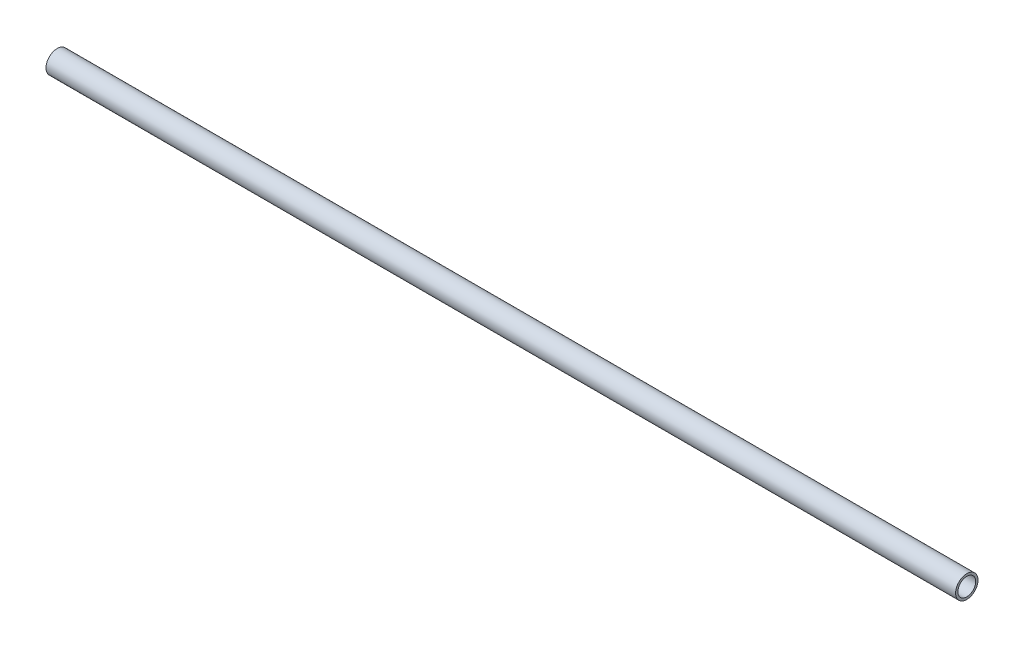
from build123d import *

# Parameters (mm, degrees)
SKETCH1_R           = 24.15
SKETCH1_R_2         = 19.15
BOSS_EXTRUDE1_DEPTH = 980


with BuildPart() as part:
    # Sketch1 → Boss-Extrude1 (new, symmetric)
    with BuildSketch(Plane(origin=(0, 0, 0), x_dir=(0, 0, -1), z_dir=(1, 0, 0))):
        Circle(SKETCH1_R)
        Circle(SKETCH1_R_2, mode=Mode.SUBTRACT)
    extrude(amount=BOSS_EXTRUDE1_DEPTH, both=True)


solid = part.part
